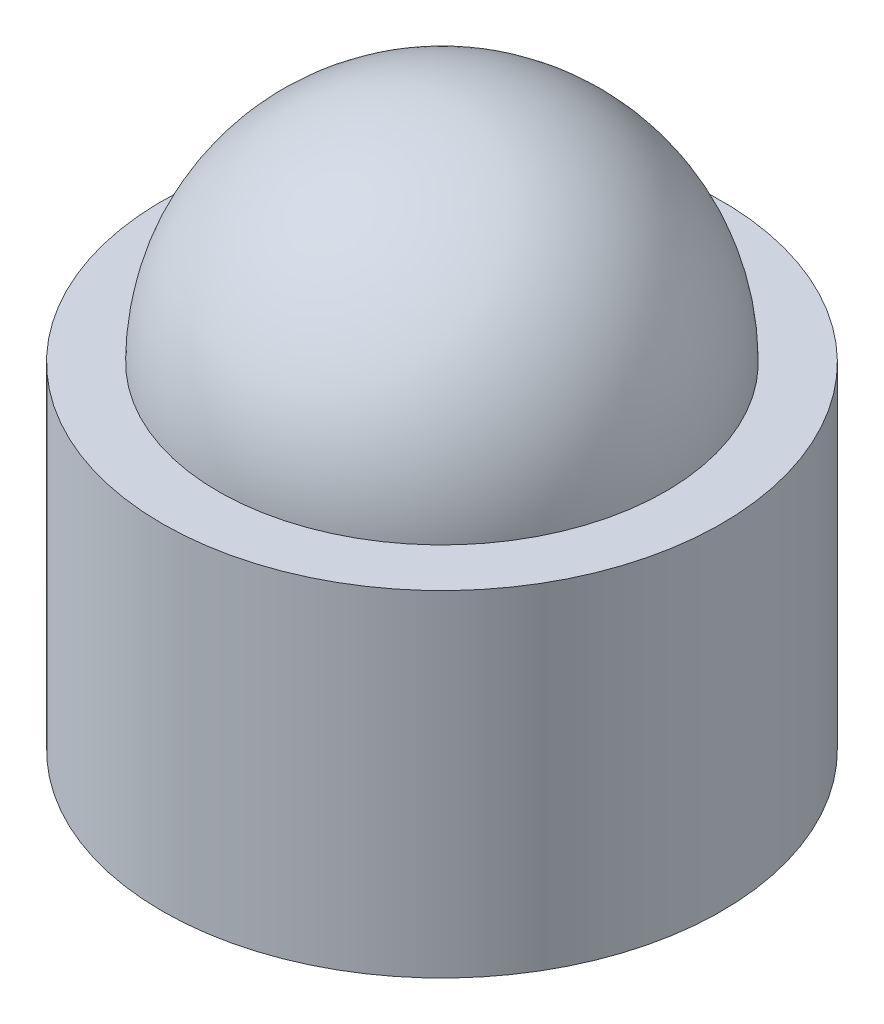
from build123d import *

# Parameters (mm, degrees)
SKETCH1_R           = 25
BOSS_EXTRUDE4_DEPTH = 30
REVOLVE1_ANGLE      = 180


with BuildPart() as part:
    # Sketch1 → Boss-Extrude4 (new body)
    with BuildSketch(Plane(origin=(0, 0, 0), x_dir=(1, 0, 0), z_dir=(0, 1, 0))):
        with Locations(Location((0, 0, 0), (0, 0, 270))):
            Circle(SKETCH1_R)
    extrude(amount=BOSS_EXTRUDE4_DEPTH)

    # Sketch3 → Revolve1 (revolve)
    with BuildSketch(Plane(origin=(0, 30, 0), x_dir=(1, 0, 0), z_dir=(0, 1, 0))):
        with BuildLine():
            Line((-9.657736042, 17.513655659), (9.657736042, -17.513655659))
            ThreePointArc((9.657736042, -17.513655659), (17.513655659, 9.657736042), (-9.657736042, 17.513655659))
        make_face()
    revolve(axis=Axis((-9.657736042, 30, -17.513655659), (0.4828868021164047, 0, 0.8756827829424262)), revolution_arc=REVOLVE1_ANGLE)


solid = part.part
